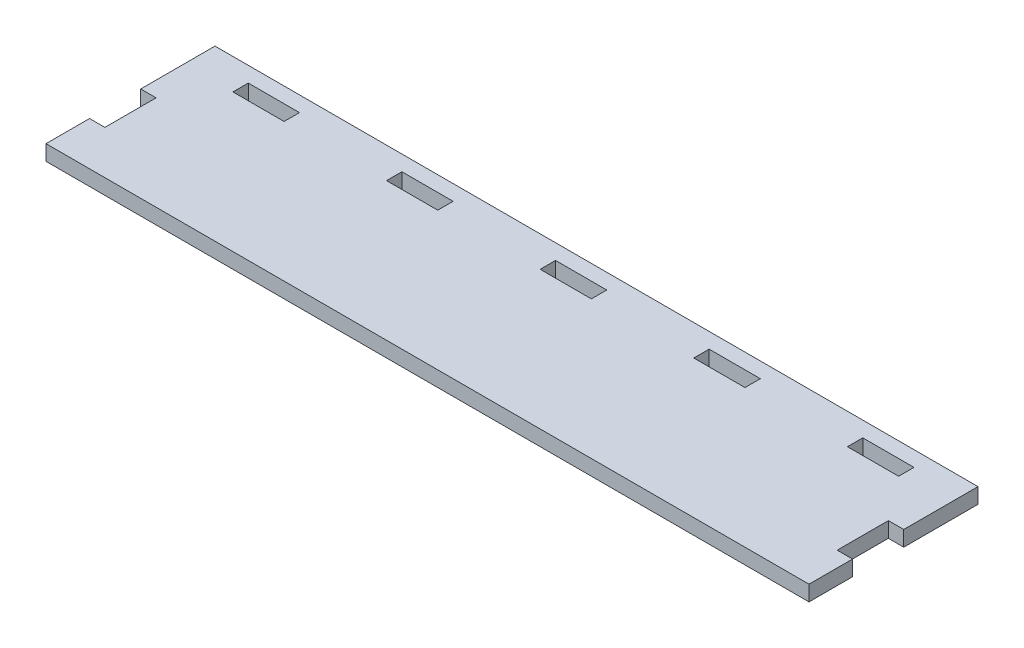
from build123d import *

# Parameters (mm, degrees)
SKETCH1_W           = 10
SKETCH1_H           = 3
BOSS_EXTRUDE1_DEPTH = 3


with BuildPart() as part:
    # Sketch1 → Boss-Extrude1 (new body)
    with BuildSketch(Plane(origin=(0, 0, 0), x_dir=(1, 0, 0), z_dir=(0, 1, 0))):
        Polygon((-74.5, 0), (74.5, 0), (74.5, -14.5), (71.5, -14.5), (71.5, -24.5), (74.5, -24.5), (74.5, -33), (-74.5, -33), (-74.5, -24.5), (-71.5, -24.5), (-71.5, -14.5), (-74.5, -14.5), align=None)
        with Locations((0, -4.5)):
            Rectangle(SKETCH1_W, SKETCH1_H, mode=Mode.SUBTRACT)
        with Locations((30, -4.5)):
            Rectangle(SKETCH1_W, SKETCH1_H, mode=Mode.SUBTRACT)
        with Locations((60, -4.5)):
            Rectangle(SKETCH1_W, SKETCH1_H, mode=Mode.SUBTRACT)
        with Locations((-60, -4.5)):
            Rectangle(SKETCH1_W, SKETCH1_H, mode=Mode.SUBTRACT)
        with Locations((-30, -4.5)):
            Rectangle(SKETCH1_W, SKETCH1_H, mode=Mode.SUBTRACT)
    extrude(amount=BOSS_EXTRUDE1_DEPTH)


solid = part.part
